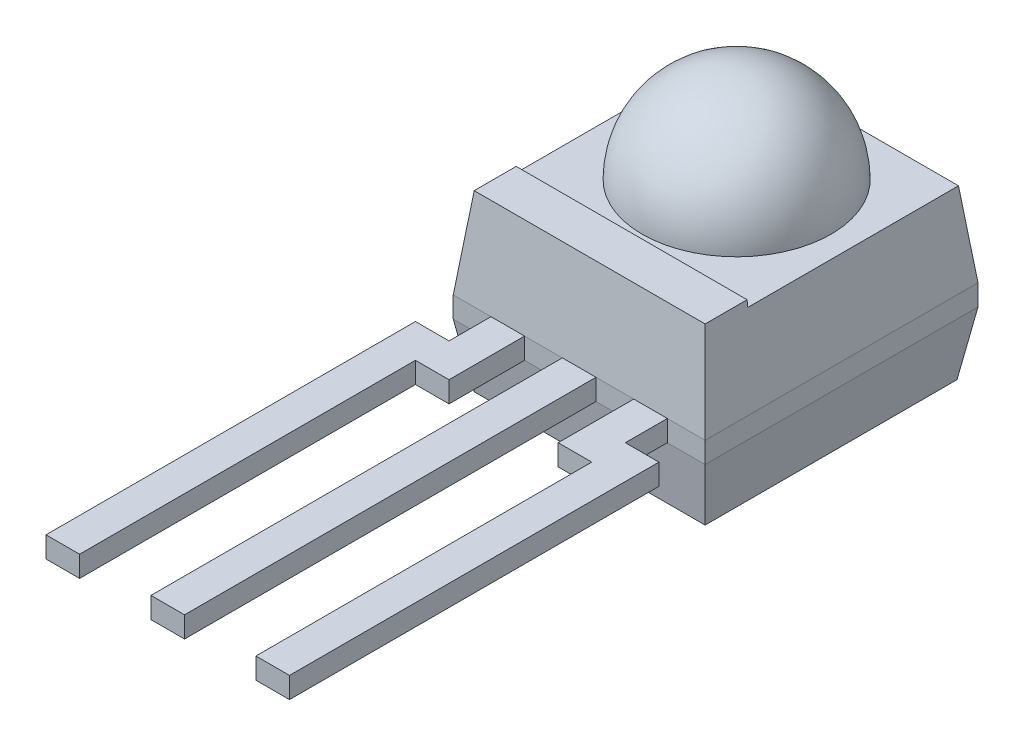
from build123d import *

# Parameters (mm, degrees)
SKETCH1_W           = 6
SKETCH1_H           = 6.5
BOSS_EXTRUDE1_DEPTH = 4
SKETCH2_W           = 0.8
SKETCH2_H           = 0.5
BOSS_EXTRUDE2_DEPTH = 1
SKETCH3_W           = 0.8
SKETCH3_H           = 8.8
BOSS_EXTRUDE3_DEPTH = 0.5
REVOLVE1_ANGLE      = 180
SKETCH5_W           = 6
SKETCH5_H           = 1.25
BOSS_EXTRUDE4_DEPTH = 0.15
CUT_EXTRUDE1_DEPTH  = 13.004270074
CUT_EXTRUDE2_DEPTH  = 16.664131


with BuildPart() as part:
    # Sketch1 → Boss-Extrude1 (new body)
    with BuildSketch(Plane(origin=(0, 0, 0), x_dir=(1, 0, 0), z_dir=(0, 1, 0))):
        Rectangle(SKETCH1_W, SKETCH1_H)
    extrude(amount=BOSS_EXTRUDE1_DEPTH)

    # Sketch2 → Boss-Extrude2 (add)
    with BuildSketch(Plane.XY.offset(3.25)):
        with Locations((-1.7, 1.75)):
            Rectangle(SKETCH2_W, SKETCH2_H)
        with Locations((0, 1.75)):
            Rectangle(SKETCH2_W, SKETCH2_H)
        with Locations((1.7, 1.75)):
            Rectangle(SKETCH2_W, SKETCH2_H)
    extrude(amount=BOSS_EXTRUDE2_DEPTH)

    # Sketch3 → Boss-Extrude3 (add)
    with BuildSketch(Plane(origin=(0, 2, 0), x_dir=(1, 0, 0), z_dir=(0, 1, 0))):
        Polygon((-1.3, -4.25), (-1.3, -5.05), (-2.1, -5.05), (-2.1, -13.05), (-2.9, -13.05), (-2.9, -4.25), (-2.1, -4.25), align=None)
        with Locations((0, -8.65)):
            Rectangle(SKETCH3_W, SKETCH3_H)
        Polygon((1.3, -4.25), (2.9, -4.25), (2.9, -13.05), (2.1, -13.05), (2.1, -5.05), (1.3, -5.05), align=None)
    extrude(amount=-BOSS_EXTRUDE3_DEPTH)

    # Sketch4 → Revolve1 (revolve)
    with BuildSketch(Plane(origin=(0, 4, 0), x_dir=(1, 0, 0), z_dir=(0, 1, 0))):
        with BuildLine():
            Line((0, 2.75), (0, -1.75))
            ThreePointArc((0, -1.75), (-2.25, 0.5), (0, 2.75))
        make_face()
    revolve(axis=Axis((0, 4, -2.75), (0, 0, -1)), revolution_arc=REVOLVE1_ANGLE)

    # Sketch5 → Boss-Extrude4 (add)
    with BuildSketch(Plane(origin=(0, 4, 0), x_dir=(1, 0, 0), z_dir=(0, 1, 0))):
        with Locations((0, -2.625)):
            Rectangle(SKETCH5_W, SKETCH5_H)
    extrude(amount=BOSS_EXTRUDE4_DEPTH)

    # Sketch6 → Cut-Extrude1 (cut, through all)
    with BuildSketch(Plane.XY.offset(3.25)):
        Polygon((-3, 2), (-2.75, 4.15), (-3, 4.15), align=None)
        Polygon((-3, 1.5), (-2.75, 0), (-3, 0), align=None)
        Polygon((3, 0), (3, 1.5), (2.75, 0), align=None)
        Polygon((3, 4.15), (3, 2), (2.75, 4.15), align=None)
    extrude(amount=-CUT_EXTRUDE1_DEPTH, mode=Mode.SUBTRACT)

    # Sketch7 → Cut-Extrude2 (cut, through all)
    with BuildSketch(Plane.ZY.offset(3)):
        Polygon((3.25, 2), (3.25, 4.15), (3, 4.15), align=None)
        Polygon((3.25, 1.5), (3.25, 0), (3, 0), align=None)
        Polygon((-3, 0), (-3.25, 1.5), (-3.25, 0), align=None)
        Polygon((-3, 4.15), (-3.25, 2), (-3.25, 4.15), align=None)
    extrude(amount=-CUT_EXTRUDE2_DEPTH, mode=Mode.SUBTRACT)


solid = part.part
